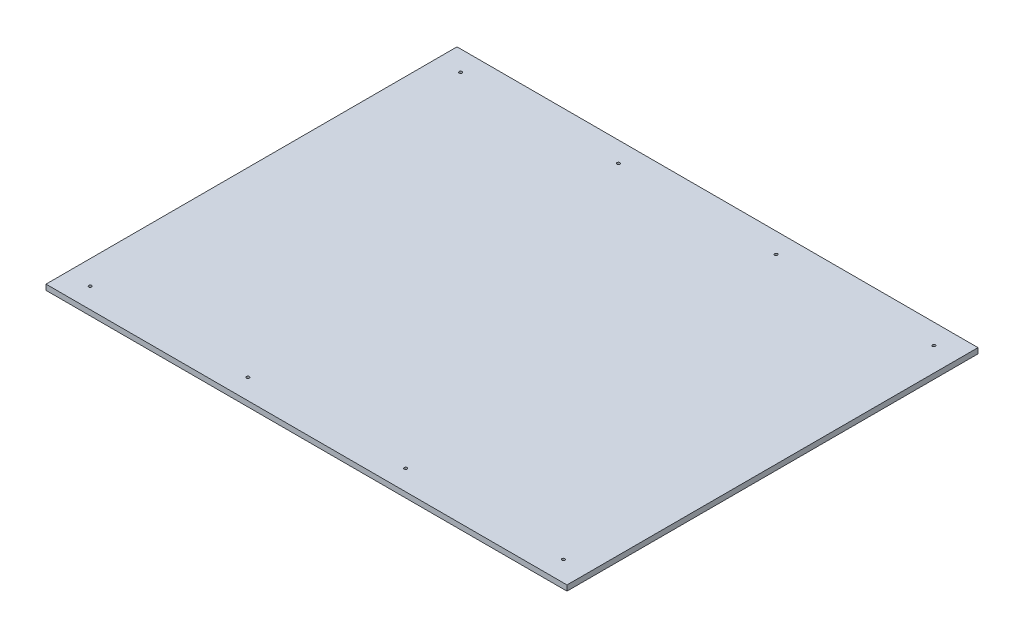
from build123d import *

# Parameters (mm, degrees)
SKETCH1_W                   = 1143
SKETCH1_H                   = 901.7
BOSS_EXTRUDE1_DEPTH         = 11.90625
F_1_4_0_25_DIAMETER_HOLE1_D = 6.35


with BuildPart() as part:
    # Sketch1 → Boss-Extrude1 (new body)
    with BuildSketch(Plane(origin=(0, 0, 0), x_dir=(1, 0, 0), z_dir=(0, 1, 0))):
        Rectangle(SKETCH1_W, SKETCH1_H)
    extrude(amount=BOSS_EXTRUDE1_DEPTH)

    # 1/4 (0.25) Diameter Hole1 (through all)
    with Locations(Plane(origin=(0, 0, 0), x_dir=(-1, 0, 0), z_dir=(0, -1, 0))):
        with Locations((519.1125, -406.4), (173.0375, -406.4), (-173.0375, -406.4), (-519.1125, -406.4), (173.0375, 406.4), (-173.0375, 406.4), (-519.1125, 406.4), (519.1125, 406.4)):
            Hole(F_1_4_0_25_DIAMETER_HOLE1_D / 2)


solid = part.part
